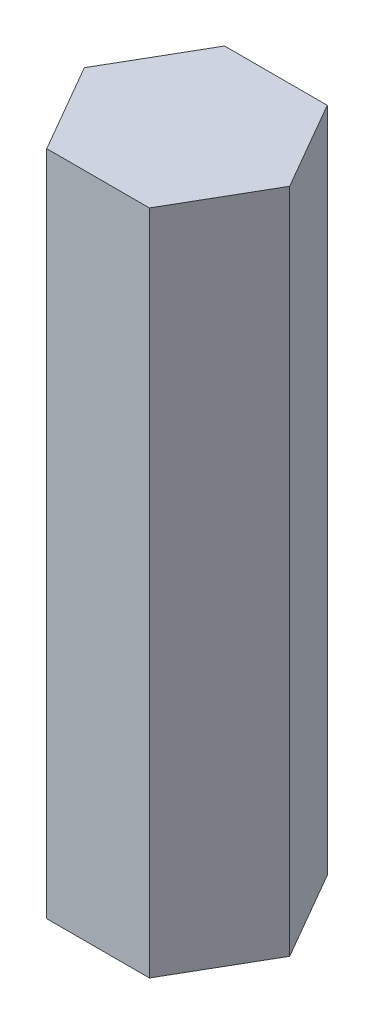
from build123d import *

# Parameters (mm, degrees)
BOSS_EXTRUDE1_DEPTH = 30


with BuildPart() as part:
    # Sketch1 → Boss-Extrude1 (new body)
    with BuildSketch(Plane(origin=(0, 0, 0), x_dir=(1, 0, 0), z_dir=(0, 1, 0))):
        Polygon((4.618802154, 0), (2.309401077, 4), (-2.309401077, 4), (-4.618802154, 0), (-2.309401077, -4), (2.309401077, -4), align=None)
    extrude(amount=BOSS_EXTRUDE1_DEPTH)


solid = part.part
